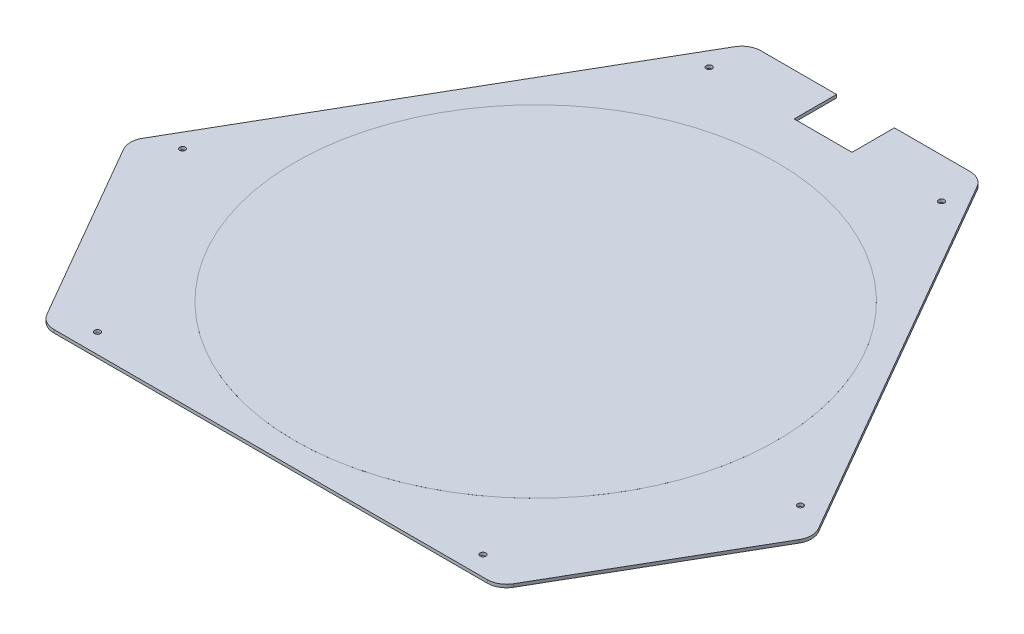
from build123d import *

# Parameters (mm, degrees)
EXTRUDE_385_DEPTH   = 1.6
FILLET_1_R          = 10
SKETCH_2_W          = 30
SKETCH_2_H          = 22
CUT_EXTRUDE_1_DEPTH = 246.888122157
SKETCH_3_R          = 125
EXTRUDE_1240_DEPTH  = 0.01
HOLE_WIZARD_3_D     = 3


with BuildPart() as part:
    # Эскиз1 → Extrude 385 (new body)
    with BuildSketch(Plane(origin=(0, 0, 0), x_dir=(1, 0, 0), z_dir=(0, 1, 0))):
        Polygon((178.156986041, -33.576951546), (60, 171.076951546), (-60, 171.076951546), (-178.156986041, -33.576951546), (-118.156986041, -137.5), (118.156986041, -137.5), align=None)
    extrude(amount=EXTRUDE_385_DEPTH)

    # Скругление1
    fillet_1_edges = [part.edges().sort_by_distance(p)[0] for p in [
        (118.156986041, 0.8, 137.5),
        (-118.156986041, 0.8, 137.5),
        (-178.156986041, 0.8, 33.576951546),
        (-60, 0.8, -171.076951546),
        (60, 0.8, -171.076951546),
        (178.156986041, 0.8, 33.576951546),
    ]]
    fillet(fillet_1_edges, radius=FILLET_1_R)

    # Эскиз2 → Вырез-Вытянуть1 (cut, through all)
    with BuildSketch(Plane(origin=(0, 1.6, 0), x_dir=(1, 0, 0), z_dir=(0, 1, 0))):
        with Locations((0, 160.076951546)):
            Rectangle(SKETCH_2_W, SKETCH_2_H)
    extrude(amount=-CUT_EXTRUDE_1_DEPTH, mode=Mode.SUBTRACT)

    # Эскиз3 → Extrude 1240 (add)
    with BuildSketch(Plane(origin=(0, 1.6, 0), x_dir=(1, 0, 0), z_dir=(0, 1, 0))):
        with Locations(Location((0, 0, 0), (0, 0, 90))):
            Circle(SKETCH_3_R)
    extrude(amount=EXTRUDE_1240_DEPTH)

    # Отверстие 3мм (through all)
    with Locations(Plane(origin=(0, 1.6, 0), x_dir=(1, 0, 0), z_dir=(0, 1, 0))):
        with Locations((-60.25, 150.255407557), (60.25, 150.255407557), (160.25, -22.9496732), (100, -127.305734356), (-100, -127.305734356), (-160.25, -22.9496732)):
            Hole(HOLE_WIZARD_3_D / 2)


solid = part.part
